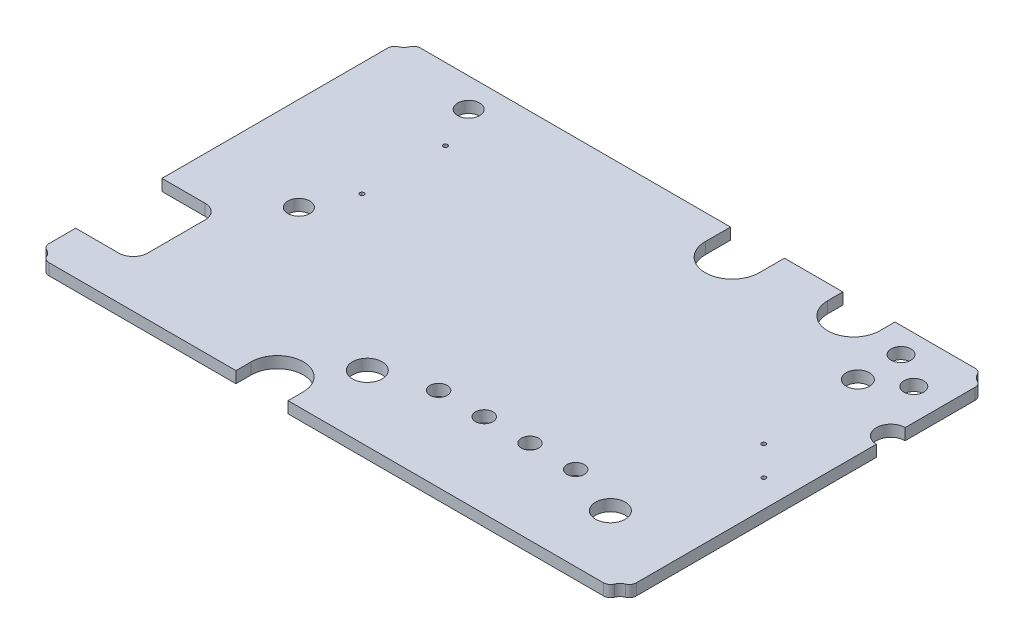
from build123d import *

# Parameters (mm, degrees)
BOSS_EXTRUDE2_DEPTH     = 1.587
SKETCH5_R               = 2.06268814
SKETCH5_R_2             = 1.20109573
SKETCH5_R_3             = 1.525
SKETCH5_R_4             = 0.3
CUT_EXTRUDE3_DEPTH      = 49.333526863
CUT_EXTRUDE4_DEPTH      = 49.333526863
CUT_EXTRUDE5_DEPTH      = 49.333526863
CUT_EXTRUDE7_DEPTH      = 49.333526863
CUT_EXTRUDE8_DEPTH      = 49.333526863
CUT_EXTRUDE9_DEPTH      = 49.333526863
CUT_EXTRUDE9_DEPTH_BACK = 49.333526863
SKETCH6_R               = 1.625
SKETCH6_R_2             = 1.375
CUT_EXTRUDE10_DEPTH     = 49.333526863
SKETCH18_R              = 0.2921
CUT_EXTRUDE11_DEPTH     = 49.333526863


with BuildPart() as part:
    # Sketch3 → Boss-Extrude2 (new body)
    with BuildSketch(Plane(origin=(0, 0, 0), x_dir=(1, 0, 0), z_dir=(0, 1, 0))):
        with BuildLine():
            Line((-38.533712153, -25.825), (38.533712153, -25.825))
            ThreePointArc((38.533712153, -25.825), (39.08143471, -25.661660027), (39.450227292, -25.225))
            ThreePointArc((39.450227292, -25.225), (39.764339828, -24.764339828), (40.225, -24.450227292))
            ThreePointArc((40.225, -24.450227292), (40.661660027, -24.08143471), (40.825, -23.533712153))
            Line((40.825, -23.533712153), (40.825, 23.533712153))
            ThreePointArc((40.825, 23.533712153), (40.661660027, 24.08143471), (40.225, 24.450227292))
            ThreePointArc((40.225, 24.450227292), (39.764339828, 24.764339828), (39.450227292, 25.225))
            ThreePointArc((39.450227292, 25.225), (39.08143471, 25.661660027), (38.533712153, 25.825))
            Line((38.533712153, 25.825), (-38.533712153, 25.825))
            ThreePointArc((-38.533712153, 25.825), (-39.08143471, 25.661660027), (-39.450227292, 25.225))
            ThreePointArc((-39.450227292, 25.225), (-39.764339828, 24.764339828), (-40.225, 24.450227292))
            ThreePointArc((-40.225, 24.450227292), (-40.661660027, 24.08143471), (-40.825, 23.533712153))
            Line((-40.825, 23.533712153), (-40.825, -23.533712153))
            ThreePointArc((-40.825, -23.533712153), (-40.661660027, -24.08143471), (-40.225, -24.450227292))
            ThreePointArc((-40.225, -24.450227292), (-39.764339828, -24.764339828), (-39.450227292, -25.225))
            ThreePointArc((-39.450227292, -25.225), (-39.08143471, -25.661660027), (-38.533712153, -25.825))
        make_face()
    extrude(amount=BOSS_EXTRUDE2_DEPTH)

    # Sketch5 → Cut-Extrude3 (cut, through all)
    with BuildSketch(Plane(origin=(0, 0, 0), x_dir=(1, 0, 0), z_dir=(0, 1, 0))):
        with Locations(Location((30.3434, -16.665, 0), (0, 0, 270))):
            Circle(SKETCH5_R)
        with Locations(Location((22.9734, -14.125, 0), (0, 0, 270))):
            Circle(SKETCH5_R_2)
        with Locations(Location((16.6234, -14.125, 0), (0, 0, 270))):
            Circle(SKETCH5_R_2)
        with Locations(Location((10.2734, -14.125, 0), (0, 0, 270))):
            Circle(SKETCH5_R_2)
        with Locations(Location((3.9234, -14.125, 0), (0, 0, 270))):
            Circle(SKETCH5_R_2)
        with Locations(Location((-3.4466, -16.665, 0), (0, 0, 270))):
            Circle(SKETCH5_R)
        with Locations(Location((-27.825419843, 21.8, 0), (0, 0, 270))):
            Circle(SKETCH5_R_3)
        with Locations(Location((-27.825419843, -1.8, 0), (0, 0, 270))):
            Circle(SKETCH5_R_3)
        with Locations(Location((-25.057419843, 15.8, 0), (0, 0, 270))):
            Circle(SKETCH5_R_4)
        with Locations(Location((-25.057419843, 4.2, 0), (0, 0, 270))):
            Circle(SKETCH5_R_4)
    extrude(amount=CUT_EXTRUDE3_DEPTH, mode=Mode.SUBTRACT)

    # Sketch8 → Cut-Extrude4 (cut, through all)
    with BuildSketch(Plane(origin=(0, 1.587, 0), x_dir=(1, 0, 0), z_dir=(0, 1, 0))):
        with BuildLine():
            Line((4.544580157, 25.825), (4.544580157, 22.32))
            ThreePointArc((4.544580157, 22.32), (8.294580157, 18.57), (12.044580157, 22.32))
            Line((12.044580157, 22.32), (12.044580157, 25.825))
            Line((12.044580157, 25.825), (4.544580157, 25.825))
        make_face()
    extrude(amount=-CUT_EXTRUDE4_DEPTH, mode=Mode.SUBTRACT)

    # Sketch9 → Cut-Extrude5 (cut, through all)
    with BuildSketch(Plane(origin=(0, 1.587, 0), x_dir=(1, 0, 0), z_dir=(0, 1, 0))):
        with BuildLine():
            Line((-40.825, -19.825), (-34.825, -19.825))
            ThreePointArc((-34.825, -19.825), (-33.410786438, -19.239213562), (-32.825, -17.825))
            Line((-32.825, -17.825), (-32.825, -9.825))
            ThreePointArc((-32.825, -9.825), (-33.410786438, -8.410786438), (-34.825, -7.825))
            Line((-34.825, -7.825), (-40.825, -7.825))
            Line((-40.825, -7.825), (-40.825, -19.825))
        make_face()
    extrude(amount=-CUT_EXTRUDE5_DEPTH, mode=Mode.SUBTRACT)

    # Sketch10 → Cut-Extrude7 (cut, through all)
    with BuildSketch(Plane(origin=(0, 1.587, 0), x_dir=(1, 0, 0), z_dir=(0, 1, 0))):
        with BuildLine():
            Line((20.165, 23.705), (20.165, 26.825))
            Line((20.165, 26.825), (27.405, 26.825))
            Line((27.405, 26.825), (27.405, 23.705))
            ThreePointArc((27.405, 23.705), (26.344726548, 21.145273452), (23.785, 20.085))
            ThreePointArc((23.785, 20.085), (21.225273452, 21.145273452), (20.165, 23.705))
        make_face()
    extrude(amount=-CUT_EXTRUDE7_DEPTH, mode=Mode.SUBTRACT)

    # Sketch12 → Cut-Extrude8 (cut, through all)
    with BuildSketch(Plane(origin=(0, 1.587, 0), x_dir=(1, 0, 0), z_dir=(0, 1, 0))):
        with BuildLine():
            Line((-12.54393673, -26.825), (-5.30393673, -26.825))
            Line((-5.30393673, -26.825), (-5.30393673, -23.705))
            ThreePointArc((-5.30393673, -23.705), (-8.92393673, -20.085), (-12.54393673, -23.705))
            Line((-12.54393673, -23.705), (-12.54393673, -26.825))
        make_face()
    extrude(amount=-CUT_EXTRUDE8_DEPTH, mode=Mode.SUBTRACT)

    # Sketch14 → Cut-Extrude9 (cut, two sides: drawn at the far end of the back side and taken through both)
    with BuildSketch(Plane(origin=(0, 1.587, 0), x_dir=(1, 0, 0), z_dir=(0, 1, 0)).offset(-CUT_EXTRUDE9_DEPTH_BACK)):
        with BuildLine():
            Line((232.361167195, 9.825), (40.825, 9.825))
            ThreePointArc((40.825, 9.825), (38.825, 11.825), (40.825, 13.825))
            Line((40.825, 13.825), (232.361167195, 13.825))
            Line((232.361167195, 13.825), (615.433501586, 13.825))
            Line((615.433501586, 13.825), (615.433501586, 9.825))
            Line((615.433501586, 9.825), (232.361167195, 9.825))
        make_face()
    extrude(amount=CUT_EXTRUDE9_DEPTH + CUT_EXTRUDE9_DEPTH_BACK, mode=Mode.SUBTRACT)

    # Sketch6 → Cut-Extrude10 (cut, through all)
    with BuildSketch(Plane(origin=(0, 1.587, 0), x_dir=(1, 0, 0), z_dir=(0, 1, 0))):
        with Locations(Location((31.75, 16.325, 0), (0, 0, 270))):
            Circle(SKETCH6_R)
        with Locations(Location((31.75, 22.325, 0), (0, 0, 270))):
            Circle(SKETCH6_R_2)
        with Locations(Location((36.477344643, 19.375, 0), (0, 0, 270))):
            Circle(SKETCH6_R_2)
    extrude(amount=-CUT_EXTRUDE10_DEPTH, mode=Mode.SUBTRACT)

    # Sketch18 → Cut-Extrude11 (cut, through all)
    with BuildSketch(Plane(origin=(0, 1.587, 0), x_dir=(1, 0, 0), z_dir=(0, 1, 0))):
        with Locations(Location((32.968, 2.032, 0), (0, 0, 270))):
            Circle(SKETCH18_R)
        with Locations(Location((37.032, -2.032, 0), (0, 0, 270))):
            Circle(SKETCH18_R)
    extrude(amount=-CUT_EXTRUDE11_DEPTH, mode=Mode.SUBTRACT)


solid = part.part
